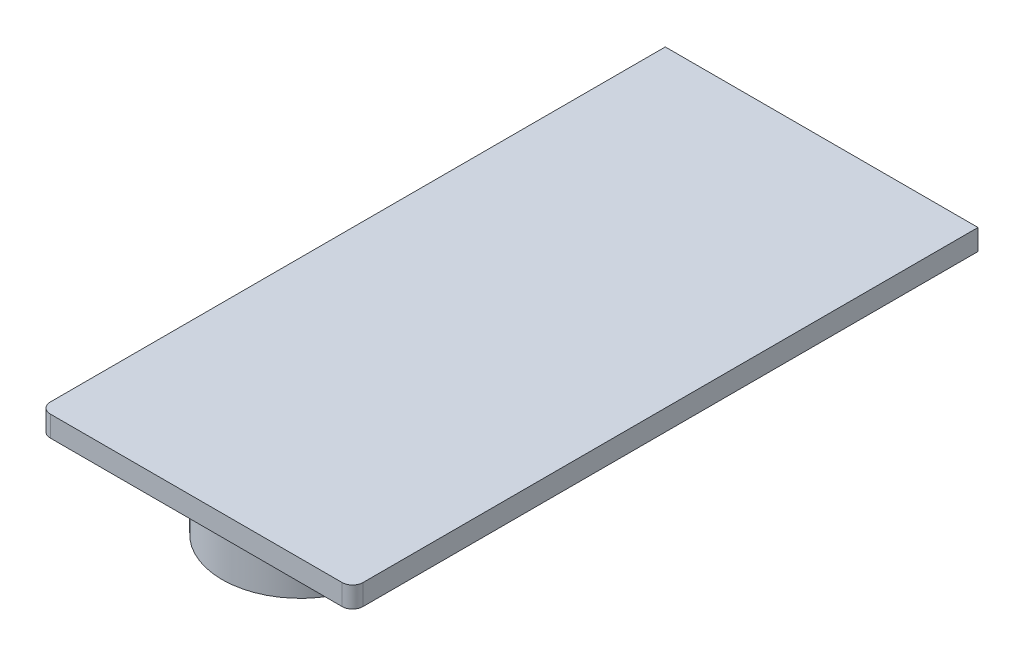
from build123d import *

# Parameters (mm, degrees)
SKETCH1_W           = 38.1
SKETCH1_H           = 76.2
BOSS_EXTRUDE1_DEPTH = 2.54
SKETCH1_3_R         = 9.549995
SKETCH1_3_R_2       = 7.05
BOSS_EXTRUDE2_DEPTH = 7.62
FILLET1_R           = 1.27


with BuildPart() as part:
    # Sketch1 → Boss-Extrude1 (new body)
    with BuildSketch(Plane(origin=(0, 0, 0), x_dir=(1, 0, 0), z_dir=(0, 1, 0))):
        with Locations((19.05, 38.1)):
            Rectangle(SKETCH1_W, SKETCH1_H)
    extrude(amount=BOSS_EXTRUDE1_DEPTH)

    # Sketch1<3> → Boss-Extrude2 (add)
    with BuildSketch(Plane(origin=(0, 0, 0), x_dir=(1, 0, 0), z_dir=(0, 1, 0))):
        with Locations((19.05, 12.7)):
            Circle(SKETCH1_3_R)
        with Locations((19.05, 12.7)):
            Circle(SKETCH1_3_R_2, mode=Mode.SUBTRACT)
    extrude(amount=-BOSS_EXTRUDE2_DEPTH)

    # Fillet1
    fillet1_edges = [part.edges().sort_by_distance(p)[0] for p in [
        (0, 1.27, 0),
        (38.1, 1.27, 0),
        (9.500005, 0, -12.7),
    ]]
    fillet(fillet1_edges, radius=FILLET1_R)


solid = part.part
